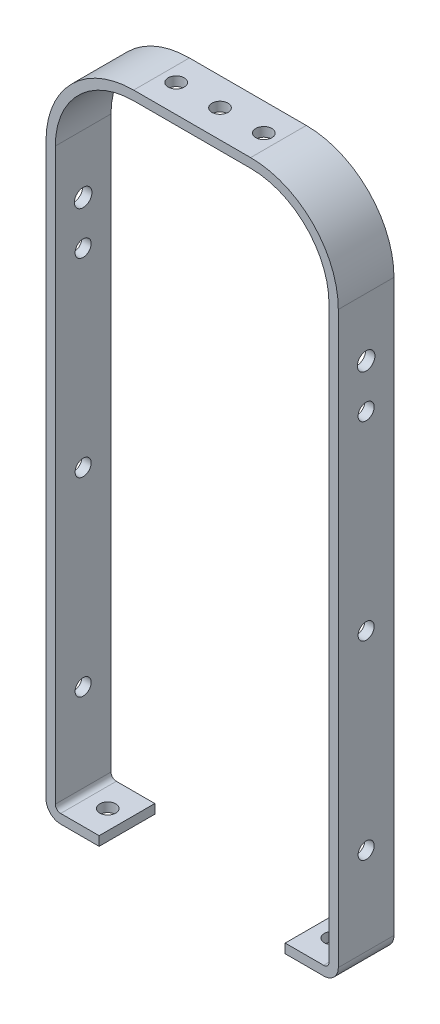
from build123d import *

# Parameters (mm, degrees)
BOSS_EXTRUDE1_DEPTH     = 9.525
SKETCH12_R              = 2.75
CUT_EXTRUDE2_DEPTH      = 236.564695201
CUT_EXTRUDE3_DEPTH      = 289.081109455
CUT_EXTRUDE3_DEPTH_BACK = 289.081109455
SKETCH13_R              = 2.75
CUT_EXTRUDE6_REACH      = 237.565
SKETCH16_R              = 2.75
CUT_EXTRUDE7_DEPTH      = 289.081109455
CUT_EXTRUDE7_DEPTH_BACK = 289.081109455
SKETCH17_R              = 3


with BuildPart() as part:
    # Sketch1 → Boss-Extrude1 (new, symmetric)
    with BuildSketch(Plane.XY):
        with BuildLine():
            Line((50, 45), (50, 240))
            ThreePointArc((50, 240), (41.213203436, 261.213203436), (20, 270))
            Line((20, 270), (-20, 270))
            ThreePointArc((-20, 270), (-41.213203436, 261.213203436), (-50, 240))
            Line((-50, 240), (-50, 45))
            ThreePointArc((-50, 45), (-48.535533906, 41.464466094), (-45, 40))
            Line((-45, 40), (-31.825, 40))
            Line((-31.825, 40), (-31.825, 43.175))
            Line((-31.825, 43.175), (-45, 43.175))
            ThreePointArc((-45, 43.175), (-46.290469876, 43.709530124), (-46.825, 45))
            Line((-46.825, 45), (-46.825, 240))
            ThreePointArc((-46.825, 240), (-38.968139405, 258.968139405), (-20, 266.825))
            Line((-20, 266.825), (20, 266.825))
            ThreePointArc((20, 266.825), (38.968139405, 258.968139405), (46.825, 240))
            Line((46.825, 240), (46.825, 45))
            ThreePointArc((46.825, 45), (46.290469876, 43.709530124), (45, 43.175))
            Line((45, 43.175), (31.825, 43.175))
            Line((31.825, 43.175), (31.825, 40))
            Line((31.825, 40), (45, 40))
            ThreePointArc((45, 40), (48.535533906, 41.464466094), (50, 45))
        make_face()
    extrude(amount=BOSS_EXTRUDE1_DEPTH, both=True)

    # Sketch12 → Cut-Extrude2 (cut, through all)
    with BuildSketch(Plane(origin=(0, 270, 0), x_dir=(1, 0, 0), z_dir=(0, 1, 0))):
        with Locations(Location((0, 0, 0), (0, 0, 270))):
            Circle(SKETCH12_R)
        with Locations(Location((-15, 0, 0), (0, 0, 270))):
            Circle(SKETCH12_R)
        with Locations(Location((15, 0, 0), (0, 0, 270))):
            Circle(SKETCH12_R)
    extrude(amount=-CUT_EXTRUDE2_DEPTH, mode=Mode.SUBTRACT)

    # Sketch13 → Cut-Extrude3 (cut, two sides: drawn at the far end of the back side and taken through both)
    with BuildSketch(Plane(origin=(50, 0, 0), x_dir=(0, 0, -1), z_dir=(1, 0, 0)).offset(-CUT_EXTRUDE3_DEPTH_BACK)):
        with Locations(Location((0, 205, 0), (0, 0, 90))):
            Circle(SKETCH13_R)
        with Locations(Location((0, 140, 0), (0, 0, 90))):
            Circle(SKETCH13_R)
        with Locations(Location((0, 75, 0), (0, 0, 90))):
            Circle(SKETCH13_R)
    extrude(amount=CUT_EXTRUDE3_DEPTH + CUT_EXTRUDE3_DEPTH_BACK, mode=Mode.SUBTRACT)

    # Sketch16 → Cut-Extrude6 (cut, up to next)
    with BuildSketch(Plane(origin=(0, 40, 0), x_dir=(-1, 0, 0), z_dir=(0, -1, 0)), mode=Mode.PRIVATE) as cut_extrude6_sk1:
        with Locations(Location((38.4125, 0, 0), (0, 0, 180))):
            Circle(SKETCH16_R)
    cut_extrude6_tool1 = extrude(cut_extrude6_sk1.sketch, amount=-CUT_EXTRUDE6_REACH, mode=Mode.PRIVATE) & part.part
    # Sketch16 → Cut-Extrude6 (cut, up to next)
    with BuildSketch(Plane(origin=(0, 40, 0), x_dir=(-1, 0, 0), z_dir=(0, -1, 0)), mode=Mode.PRIVATE) as cut_extrude6_sk2:
        with Locations(Location((-38.4125, 0, 0), (0, 0, 180))):
            Circle(SKETCH16_R)
    cut_extrude6_tool2 = extrude(cut_extrude6_sk2.sketch, amount=-CUT_EXTRUDE6_REACH, mode=Mode.PRIVATE) & part.part
    add(cut_extrude6_tool1.solids().sort_by_distance((-38.4125, 40, 0))[0], mode=Mode.SUBTRACT)
    add(cut_extrude6_tool2.solids().sort_by_distance((38.4125, 40, 0))[0], mode=Mode.SUBTRACT)

    # Sketch17 → Cut-Extrude7 (cut, two sides: drawn at the far end of the back side and taken through both)
    with BuildSketch(Plane(origin=(50, 0, 0), x_dir=(0, 0, -1), z_dir=(1, 0, 0)).offset(-CUT_EXTRUDE7_DEPTH_BACK)):
        with Locations(Location((0, 220, 0), (0, 0, 90))):
            Circle(SKETCH17_R)
    extrude(amount=CUT_EXTRUDE7_DEPTH + CUT_EXTRUDE7_DEPTH_BACK, mode=Mode.SUBTRACT)


solid = part.part
